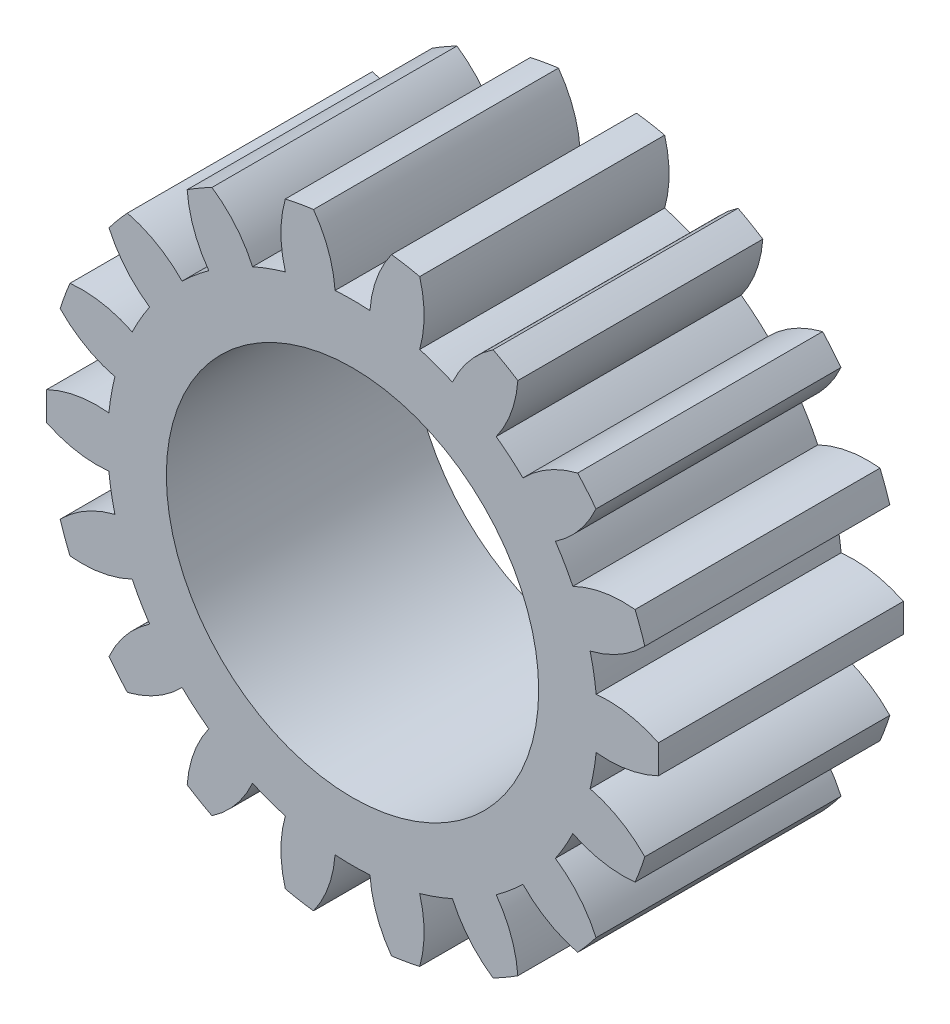
from build123d import *

# Parameters (mm, degrees)
SKETCH1_R               = 7.9375
OUTER_CIRCLE_DEPTH      = 6.35
TOOTH_CUT_DEPTH         = 13.896910967
TEETH_PATTERN_COUNT     = 18
CUT_EXTRUDE1_DEPTH      = 12.621761341
CUT_EXTRUDE1_DEPTH_BACK = 12.621761341
PITCH_DIAMETER_R        = 4.826


with BuildPart() as part:
    # Sketch1 → Outer Circle (new body)
    with BuildSketch(Plane.XY):
        Circle(SKETCH1_R)
    extrude(amount=OUTER_CIRCLE_DEPTH)

    # Sketch2 → Tooth Cut (cut, through all)
    with BuildSketch(Plane.XY.offset(6.35)):
        with BuildLine():
            ThreePointArc((-0.452232993, 6.333876011), (0, 6.35), (0.452232993, 6.333876011))
            ThreePointArc((0.452232993, 6.333876011), (0.624488533, 7.142351531), (1.011484471, 7.872788922))
            ThreePointArc((1.011484471, 7.872788922), (0, 7.9375), (-1.011484471, 7.872788922))
            ThreePointArc((-1.011484471, 7.872788922), (-0.624488533, 7.142351531), (-0.452232993, 6.333876011))
        make_face()
    tooth_cut = extrude(amount=-TOOTH_CUT_DEPTH, mode=Mode.SUBTRACT)

    # Teeth Pattern: Tooth Cut ×18 about axis
    teeth_pattern_axis = Axis((0, 0, 0), (0, 0, 1))
    for i in range(1, TEETH_PATTERN_COUNT):
        add(tooth_cut.rotate(teeth_pattern_axis, i * 360 / TEETH_PATTERN_COUNT), mode=Mode.SUBTRACT)

    # Pitch Diameter → Cut-Extrude1 (cut, two sides: drawn at the far end of the back side and taken through both)
    with BuildSketch(Plane.XY.offset(3.175).offset(-CUT_EXTRUDE1_DEPTH_BACK)):
        Circle(PITCH_DIAMETER_R)
    extrude(amount=CUT_EXTRUDE1_DEPTH + CUT_EXTRUDE1_DEPTH_BACK, mode=Mode.SUBTRACT)


solid = part.part
